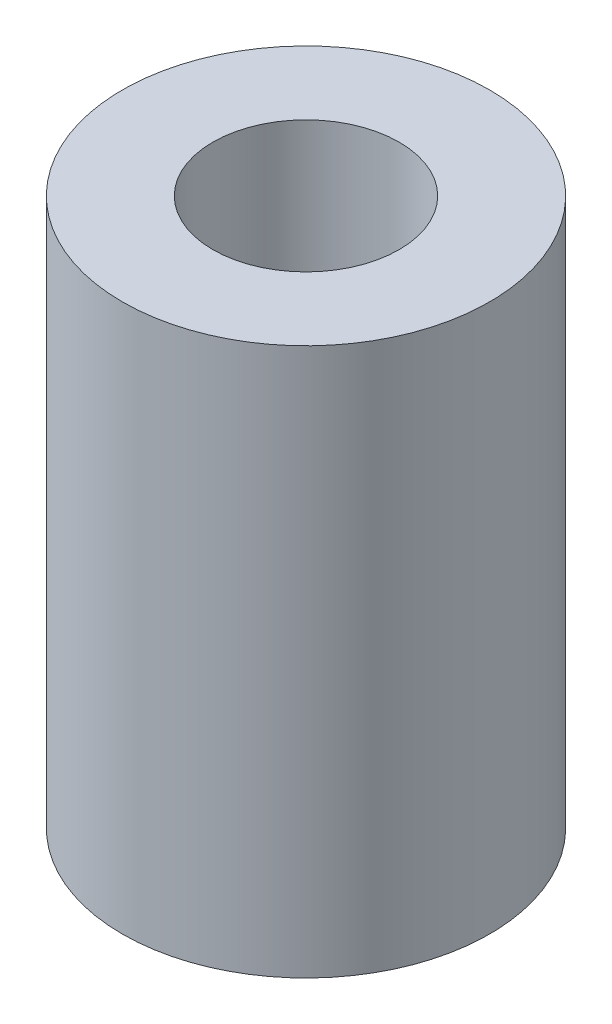
from build123d import *

# Parameters (mm, degrees)
ESBO_O1_R                = 18.32
ESBO_O1_R_2              = 9.295
RESSALTO_EXTRUS_O1_DEPTH = 54.63


with BuildPart() as part:
    # Esboço1 → Ressalto-extrusão1 (new body)
    with BuildSketch(Plane(origin=(0, 0, 0), x_dir=(1, 0, 0), z_dir=(0, 1, 0))):
        with Locations(Location((0, 0, 0), (0, 0, 270))):
            Circle(ESBO_O1_R)
        with Locations(Location((0, 0, 0), (0, 0, 270))):
            Circle(ESBO_O1_R_2, mode=Mode.SUBTRACT)
    extrude(amount=RESSALTO_EXTRUS_O1_DEPTH)


solid = part.part
